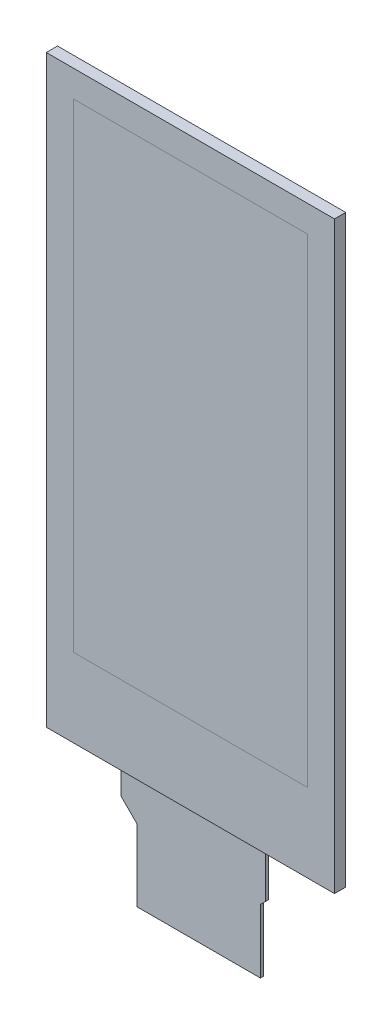
from build123d import *

# Parameters (mm, degrees)
SKETCH1_W           = 23.705
SKETCH1_H           = 48.55
BOSS_EXTRUDE1_DEPTH = 1.14
SKETCH1_3_W         = 23.705
SKETCH1_3_H         = 48.55
BOSS_EXTRUDE2_DEPTH = 1.14
BOSS_EXTRUDE3_DEPTH = 0.3


with BuildPart() as part:
    # Sketch1 → Boss-Extrude1 (new body)
    with BuildSketch(Plane.XY):
        Rectangle(SKETCH1_W, SKETCH1_H)
    extrude(amount=BOSS_EXTRUDE1_DEPTH)


with BuildPart() as body_2:
    # Sketch1<3> → Boss-Extrude2 (new body)
    with BuildSketch(Plane.XY):
        Polygon((-14.5995, -32.225), (-7.883036535, -32.225), (6.770331425, -32.225), (14.6005, -32.225), (14.6005, 26.975), (-14.5995, 26.975), align=None)
        Rectangle(SKETCH1_3_W, SKETCH1_3_H, mode=Mode.SUBTRACT)
    extrude(amount=BOSS_EXTRUDE2_DEPTH)


with BuildPart() as body_3:
    # Sketch1<4> → Boss-Extrude3 (new body)
    with BuildSketch(Plane.XY):
        Polygon((6.770331425, -32.225), (-7.883036535, -32.225), (-7.883036535, -35.317247683), (-6.2495, -36.950784218), (-6.2495, -44.225), (6.2505, -44.225), (6.2505, -37.771811116), (6.770331425, -37.251979691), align=None)
    extrude(amount=BOSS_EXTRUDE3_DEPTH)


solid = Compound([part.part, body_2.part, body_3.part])
